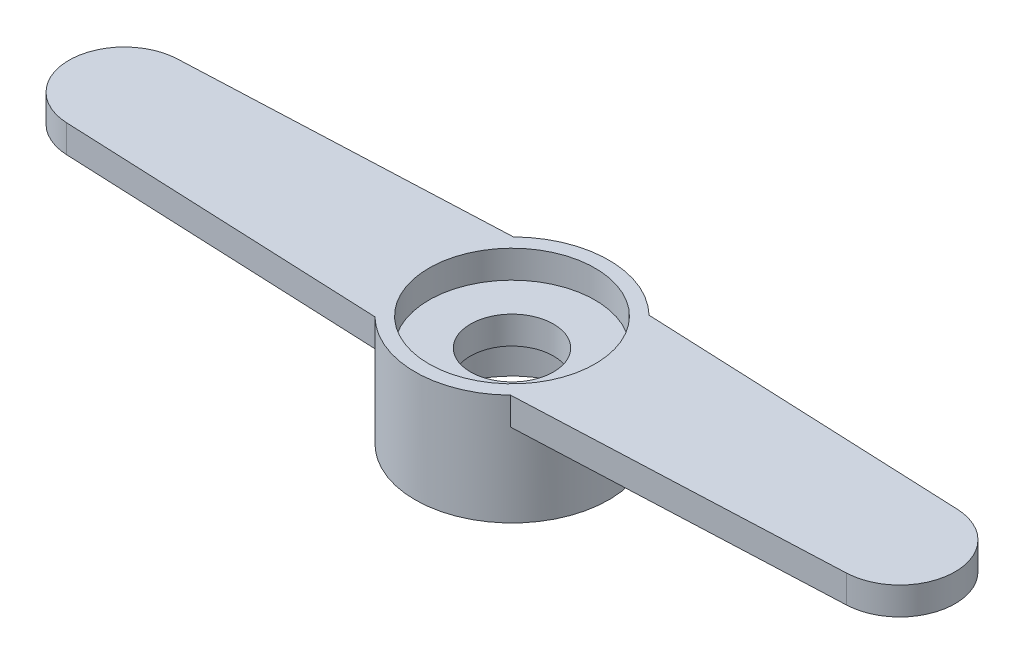
from build123d import *

# Parameters (mm, degrees)
SKETCH_1_R          = 3.5
SKETCH_1_R_2        = 1.5
EXTRUDE_1_DEPTH     = 4
SKETCH_2_R          = 3
CUT_EXTRUDE_1_DEPTH = 2
CUT_EXTRUDE_START   = -1
SKETCH_3_R          = 3
CUT_EXTRUDE_2_DEPTH = 1
EXTRUDE_START       = -1
SKETCH_4_R          = 2
EXTRUDE_2_DEPTH     = 1


with BuildPart() as part:
    # 草图1 → 凸台-拉伸1 (new body)
    with BuildSketch(Plane(origin=(0, 0, 0), x_dir=(1, 0, 0), z_dir=(0, 1, 0))):
        with Locations(Location((0, 0, 0), (0, 0, 270))):
            Circle(SKETCH_1_R)
        with Locations(Location((0, 0, 0), (0, 0, 270))):
            Circle(SKETCH_1_R_2, mode=Mode.SUBTRACT)
    extrude(amount=EXTRUDE_1_DEPTH)

    # 草图2 → 切除-拉伸1 (cut)
    with BuildSketch(Plane.XZ):
        with Locations(Location((0, 0, 0), (0, 0, 270))):
            Circle(SKETCH_2_R)
    extrude(amount=-CUT_EXTRUDE_1_DEPTH, mode=Mode.SUBTRACT)

    # 草图3 → 切除-拉伸2 (cut)
    with BuildSketch(Plane(origin=(0, 4, 0), x_dir=(1, 0, 0), z_dir=(0, 1, 0)).offset(CUT_EXTRUDE_START)):
        with Locations(Location((0, 0, 0), (0, 0, 90))):
            Circle(SKETCH_3_R)
    extrude(amount=CUT_EXTRUDE_2_DEPTH, mode=Mode.SUBTRACT)

    # 草图4 → 凸台-拉伸2 (add)
    with BuildSketch(Plane(origin=(0, 4, 0), x_dir=(1, 0, 0), z_dir=(0, 1, 0)).offset(EXTRUDE_START)):
        with BuildLine():
            ThreePointArc((-2.449489743, -2.5), (-3.5, 0), (-2.449489743, 2.5))
            Line((-2.449489743, 2.5), (-14.086174253, 1.998142637))
            ThreePointArc((-14.086174253, 1.998142637), (-12.61658909, 1.444359461), (-12, 0))
            ThreePointArc((-12, 0), (-12.61658909, -1.444359461), (-14.086174253, -1.998142637))
            Line((-14.086174253, -1.998142637), (-2.449489743, -2.5))
        make_face()
        with BuildLine():
            ThreePointArc((14.086174253, -1.998142637), (12, 0), (14.086174253, 1.998142637))
            Line((14.086174253, 1.998142637), (2.449489743, 2.5))
            ThreePointArc((2.449489743, 2.5), (3.226702194, 1.355873501), (3.5, 0))
            ThreePointArc((3.5, 0), (3.226702194, -1.355873501), (2.449489743, -2.5))
            Line((2.449489743, -2.5), (14.086174253, -1.998142637))
        make_face()
        with Locations((-14, 0)):
            Circle(SKETCH_4_R)
        with Locations((14, 0)):
            Circle(SKETCH_4_R)
    extrude(amount=EXTRUDE_2_DEPTH)


solid = part.part
